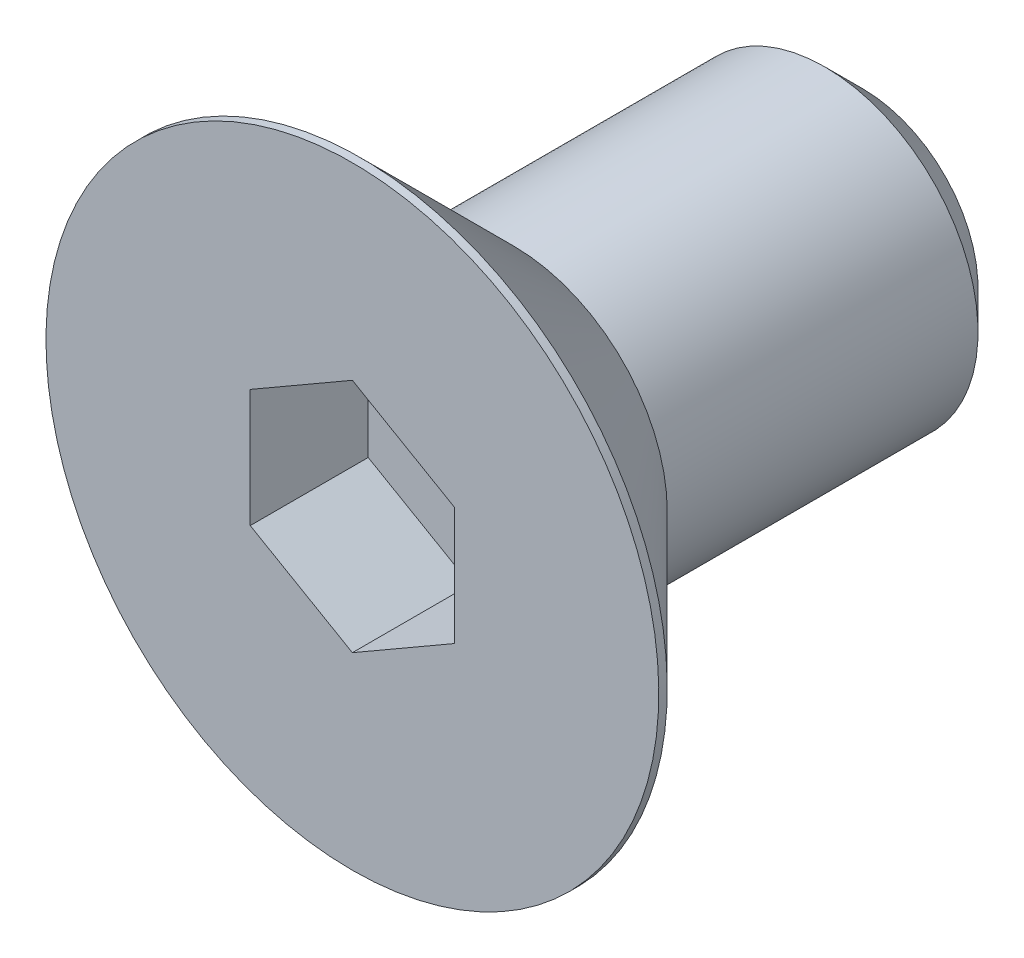
from build123d import *

# Parameters (mm, degrees)
CHAMFER1_SIZE      = 0.75
CUT_EXTRUDE2_DEPTH = 2.31


with BuildPart() as part:
    # Sketch1 → Revolve1 (revolve)
    with BuildSketch(Plane(origin=(0, 0, 0), x_dir=(0, 0, -1), z_dir=(1, 0, 0))):
        Polygon((-1.7, 3), (5, 3), (5, 0), (-2.69, 0), (-2.69, 3), align=None)
    revolve(axis=Axis((0, 0, 2.69), (0, 0, -1)))

    # Chamfer1
    chamfer1_edges = [part.edges().sort_by_distance(p)[0] for p in [
        (0, -3, -5),
    ]]
    chamfer(chamfer1_edges, length=CHAMFER1_SIZE)


with BuildPart() as body_2:
    # Sketch7 → Revolve2 (revolve)
    with BuildSketch(Plane(origin=(0, 0, 0), x_dir=(0, 0, -1), z_dir=(1, 0, 0))):
        Polygon((-4.835, 6), (-5, 6), (-5, 0), (-1.7, 0), (-1.7, 2.865), align=None)
    revolve(axis=Axis((0, 0, 5), (0, 0, -1)))

    # Sketch5 → Cut-Extrude2 (cut)
    with BuildSketch(Plane.XY.offset(5)):
        Polygon((2, -1.154700538), (2, 1.154700538), (0, 2.309401077), (-2, 1.154700538), (-2, -1.154700538), (0, -2.309401077), align=None)
    extrude(amount=-CUT_EXTRUDE2_DEPTH, mode=Mode.SUBTRACT)


solid = Compound([part.part, body_2.part])
